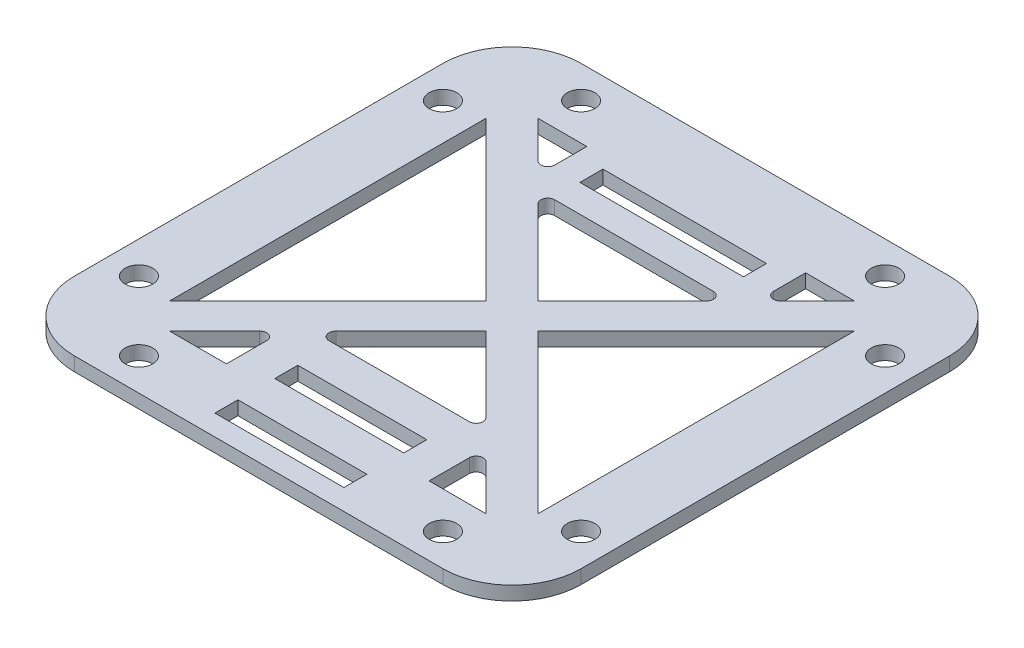
from build123d import *

# Parameters (mm, degrees)
SKETCH1_R           = 3
BOSS_EXTRUDE1_DEPTH = 3
SKETCH2_W           = 28
SKETCH2_H           = 5
SKETCH2_W_2         = 35.5
CUT_EXTRUDE1_DEPTH  = 79.545892535
CUT_EXTRUDE2_DEPTH  = 79.545892535
FILLET1_R           = 1.5
SKETCH4_W           = 28
SKETCH4_H           = 5
CUT_EXTRUDE3_DEPTH  = 79.545892535


with BuildPart() as part:
    # Sketch1 → Boss-Extrude1 (new body)
    with BuildSketch(Plane(origin=(0, 0, 0), x_dir=(1, 0, 0), z_dir=(0, 1, 0))):
        with BuildLine():
            Line((55.872458647, -40.12463695), (55.872458647, 39.87536305))
            ThreePointArc((55.872458647, 39.87536305), (51.479060365, 50.481964768), (40.872458647, 54.87536305))
            Line((40.872458647, 54.87536305), (-39.127541353, 54.87536305))
            ThreePointArc((-39.127541353, 54.87536305), (-49.734143071, 50.481964768), (-54.127541353, 39.87536305))
            Line((-54.127541353, 39.87536305), (-54.127541353, -40.12463695))
            ThreePointArc((-54.127541353, -40.12463695), (-49.734143071, -50.731238667), (-39.127541353, -55.12463695))
            Line((-39.127541353, -55.12463695), (40.872458647, -55.12463695))
            ThreePointArc((40.872458647, -55.12463695), (51.479060365, -50.731238667), (55.872458647, -40.12463695))
        make_face()
        with Locations(Location((48.872458647, 32.87536305, 0), (0, 0, 270))):
            Circle(SKETCH1_R, mode=Mode.SUBTRACT)
        with Locations(Location((-47.127541353, -33.12463695, 0), (0, 0, 270))):
            Circle(SKETCH1_R, mode=Mode.SUBTRACT)
        with Locations(Location((-32.127541353, -48.12463695, 0), (0, 0, 270))):
            Circle(SKETCH1_R, mode=Mode.SUBTRACT)
        with Locations(Location((33.872458647, -48.12463695, 0), (0, 0, 270))):
            Circle(SKETCH1_R, mode=Mode.SUBTRACT)
        with Locations(Location((48.872458647, -33.12463695, 0), (0, 0, 270))):
            Circle(SKETCH1_R, mode=Mode.SUBTRACT)
        with Locations(Location((33.872458647, 47.87536305, 0), (0, 0, 270))):
            Circle(SKETCH1_R, mode=Mode.SUBTRACT)
        with Locations(Location((-32.127541353, 47.87536305, 0), (0, 0, 270))):
            Circle(SKETCH1_R, mode=Mode.SUBTRACT)
        with Locations(Location((-47.127541353, 32.87536305, 0), (0, 0, 270))):
            Circle(SKETCH1_R, mode=Mode.SUBTRACT)
    extrude(amount=BOSS_EXTRUDE1_DEPTH)

    # Sketch2 → Cut-Extrude1 (cut, through all)
    with BuildSketch(Plane(origin=(0, 3, 0), x_dir=(1, 0, 0), z_dir=(0, 1, 0))):
        with Locations((0.872458647, -35.12463695)):
            Rectangle(SKETCH2_W, SKETCH2_H)
        with Locations((0.872458647, 34.87536305)):
            Rectangle(SKETCH2_W_2, SKETCH2_H)
    extrude(amount=-CUT_EXTRUDE1_DEPTH, mode=Mode.SUBTRACT)

    # Sketch3 → Cut-Extrude2 (cut, through all)
    with BuildSketch(Plane(origin=(0, 3, 0), x_dir=(1, 0, 0), z_dir=(0, 1, 0))):
        Polygon((-39.127541353, 34.218508801), (-4.784395603, -0.12463695), (-39.127541353, -34.4677827), align=None)
        Polygon((-33.470687104, -40.12463695), (-21.127541353, -40.12463695), (-21.127541353, -27.781491199), align=None)
        Polygon((-33.470687104, 39.87536305), (-22.877541353, 39.87536305), (-22.877541353, 29.2822173), align=None)
        Polygon((40.872458647, -34.4677827), (40.872458647, 34.218508801), (6.529312896, -0.12463695), align=None)
        Polygon((24.622458647, 29.2822173), (24.622458647, 39.87536305), (35.215604397, 39.87536305), align=None)
        Polygon((-19.970687104, 26.37536305), (21.715604397, 26.37536305), (0.872458647, 5.5322173), align=None)
        Polygon((22.872458647, -40.12463695), (35.215604397, -40.12463695), (22.872458647, -27.781491199), align=None)
        Polygon((19.715604397, -24.62463695), (-17.970687104, -24.62463695), (0.872458647, -5.781491199), align=None)
    extrude(amount=-CUT_EXTRUDE2_DEPTH, mode=Mode.SUBTRACT)

    # Fillet1
    fillet1_edges = [part.edges().sort_by_distance(p)[0] for p in [
        (22.872458647, 1.5, 27.781491199),
        (-21.127541353, 1.5, 27.781491199),
        (24.622458647, 1.5, -29.2822173),
        (-19.970687104, 1.5, -26.37536305),
        (21.715604397, 1.5, -26.37536305),
        (19.715604397, 1.5, 24.62463695),
        (-17.970687104, 1.5, 24.62463695),
        (-22.877541353, 1.5, -29.2822173),
    ]]
    fillet(fillet1_edges, radius=FILLET1_R)

    # Sketch4 → Cut-Extrude3 (cut, through all)
    with BuildSketch(Plane(origin=(0, 3, 0), x_dir=(1, 0, 0), z_dir=(0, 1, 0))):
        with Locations((0.872458647, -48.12463695)):
            Rectangle(SKETCH4_W, SKETCH4_H)
    extrude(amount=-CUT_EXTRUDE3_DEPTH, mode=Mode.SUBTRACT)


solid = part.part
